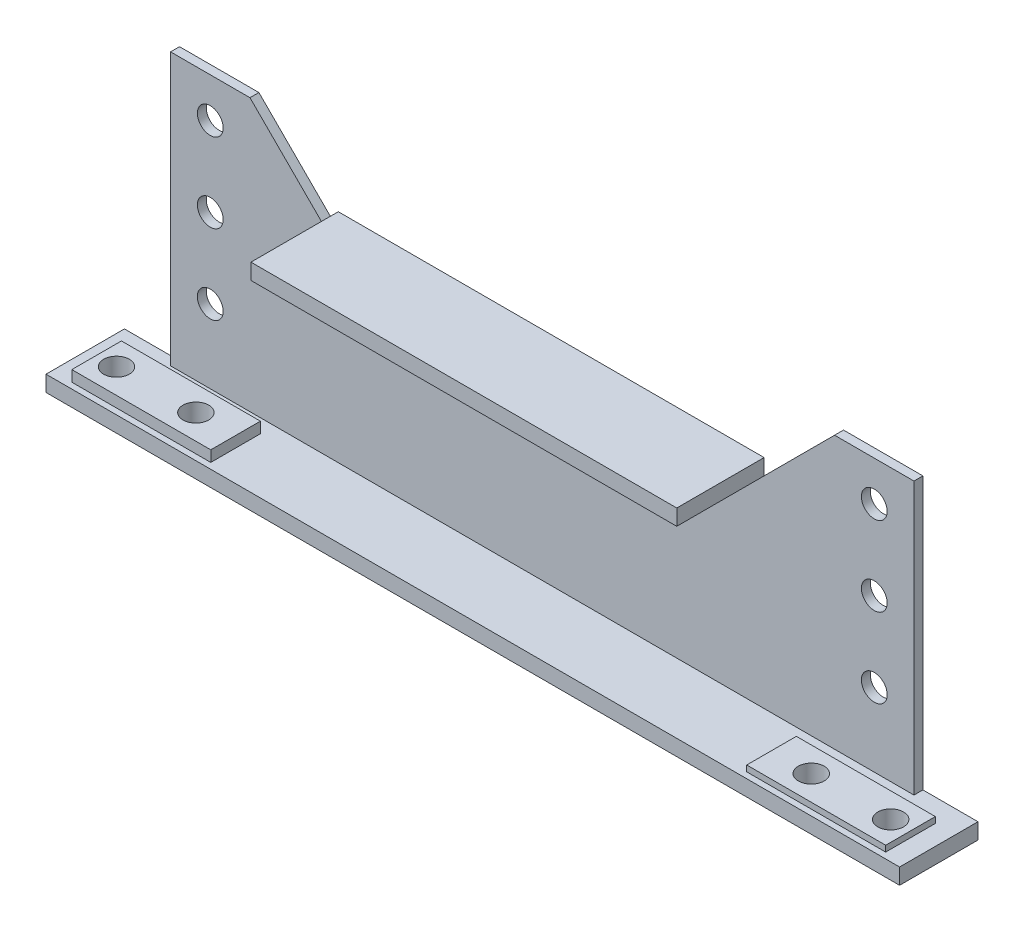
from build123d import *

# Parameters (mm, degrees)
SKETCH_1_R             = 13
EXTRUDE_2_DEPTH        = 9
SKETCH_3_W             = 860
SKETCH_3_H             = 16
EXTRUDE_3_DEPTH        = 70
SKETCH_4_W             = 140
SKETCH_4_H             = 50
EXTRUDE_5_DEPTH        = 11
SKETCH_5_R             = 13
CUT_EXTRUDE_2_DEPTH    = 903.779042734
PATTERN_LINEAR_1_COUNT = 2
PATTERN_LINEAR_1_PITCH = 80
SKETCH_6_W             = 140
SKETCH_6_H             = 50
EXTRUDE_6_DEPTH        = 6
SKETCH_7_R             = 13
CUT_EXTRUDE_3_DEPTH    = 905.248306606
PATTERN_LINEAR_2_COUNT = 2
PATTERN_LINEAR_2_PITCH = 80
SKETCH_10_W            = 429
SKETCH_10_H            = 16
EXTRUDE_8_DEPTH        = 79


with BuildPart() as part:
    # 草图1 → 凸台-拉伸2 (new body)
    with BuildSketch(Plane.XY):
        Polygon((0, 0), (860, 0), (860, 16), (804.5, 16), (804.5, 290), (724.5, 290), (644.5, 210), (644.5, 226), (215.5, 226), (215.5, 210), (135.5, 290), (55.5, 290), (55.5, 16), (0, 16), align=None)
        with Locations((95.5, 90)):
            Circle(SKETCH_1_R, mode=Mode.SUBTRACT)
        with Locations((95.5, 170)):
            Circle(SKETCH_1_R, mode=Mode.SUBTRACT)
        with Locations((95.5, 250)):
            Circle(SKETCH_1_R, mode=Mode.SUBTRACT)
        with Locations((764.5, 90)):
            Circle(SKETCH_1_R, mode=Mode.SUBTRACT)
        with Locations((764.5, 170)):
            Circle(SKETCH_1_R, mode=Mode.SUBTRACT)
        with Locations((764.5, 250)):
            Circle(SKETCH_1_R, mode=Mode.SUBTRACT)
    extrude(amount=EXTRUDE_2_DEPTH)

    # 草图3 → 凸台-拉伸3 (add)
    with BuildSketch(Plane.XY.offset(9)):
        with Locations((430, 8)):
            Rectangle(SKETCH_3_W, SKETCH_3_H)
    extrude(amount=EXTRUDE_3_DEPTH)

    # 草图4 → 凸台-拉伸5 (add)
    with BuildSketch(Plane(origin=(0, 16, 0), x_dir=(1, 0, 0), z_dir=(0, 1, 0))):
        with Locations((90, -48)):
            Rectangle(SKETCH_4_W, SKETCH_4_H)
    extrude(amount=EXTRUDE_5_DEPTH)

    # 草图5 → 切除-拉伸2 (cut, through all)
    with BuildSketch(Plane(origin=(0, 27, 0), x_dir=(1, 0, 0), z_dir=(0, 1, 0))):
        with Locations(Location((40, -48, 0), (0, 0, 270))):
            Circle(SKETCH_5_R)
    cut_extrude_2 = extrude(amount=-CUT_EXTRUDE_2_DEPTH, mode=Mode.SUBTRACT)

    # 阵列(线性)1: 切除-拉伸2 ×2
    with Locations(*[(i * PATTERN_LINEAR_1_PITCH, 0, 0) for i in range(1, PATTERN_LINEAR_1_COUNT)]):
        add(cut_extrude_2, mode=Mode.SUBTRACT)

    # 草图6 → 凸台-拉伸6 (add)
    with BuildSketch(Plane(origin=(0, 16, 0), x_dir=(1, 0, 0), z_dir=(0, 1, 0))):
        with Locations((770, -48)):
            Rectangle(SKETCH_6_W, SKETCH_6_H)
    extrude(amount=EXTRUDE_6_DEPTH)

    # 草图7 → 切除-拉伸3 (cut, through all)
    with BuildSketch(Plane(origin=(0, 22, 0), x_dir=(1, 0, 0), z_dir=(0, 1, 0))):
        with Locations(Location((820, -48, 0), (0, 0, 270))):
            Circle(SKETCH_7_R)
    cut_extrude_3 = extrude(amount=-CUT_EXTRUDE_3_DEPTH, mode=Mode.SUBTRACT)

    # 阵列(线性)2: 切除-拉伸3 ×2
    with Locations(*[(-i * PATTERN_LINEAR_2_PITCH, 0, 0) for i in range(1, PATTERN_LINEAR_2_COUNT)]):
        add(cut_extrude_3, mode=Mode.SUBTRACT)

    # 草图10 → 凸台-拉伸8 (add)
    with BuildSketch(Plane.XY.offset(9)):
        with Locations((430, 218)):
            Rectangle(SKETCH_10_W, SKETCH_10_H)
    extrude(amount=EXTRUDE_8_DEPTH)


solid = part.part
